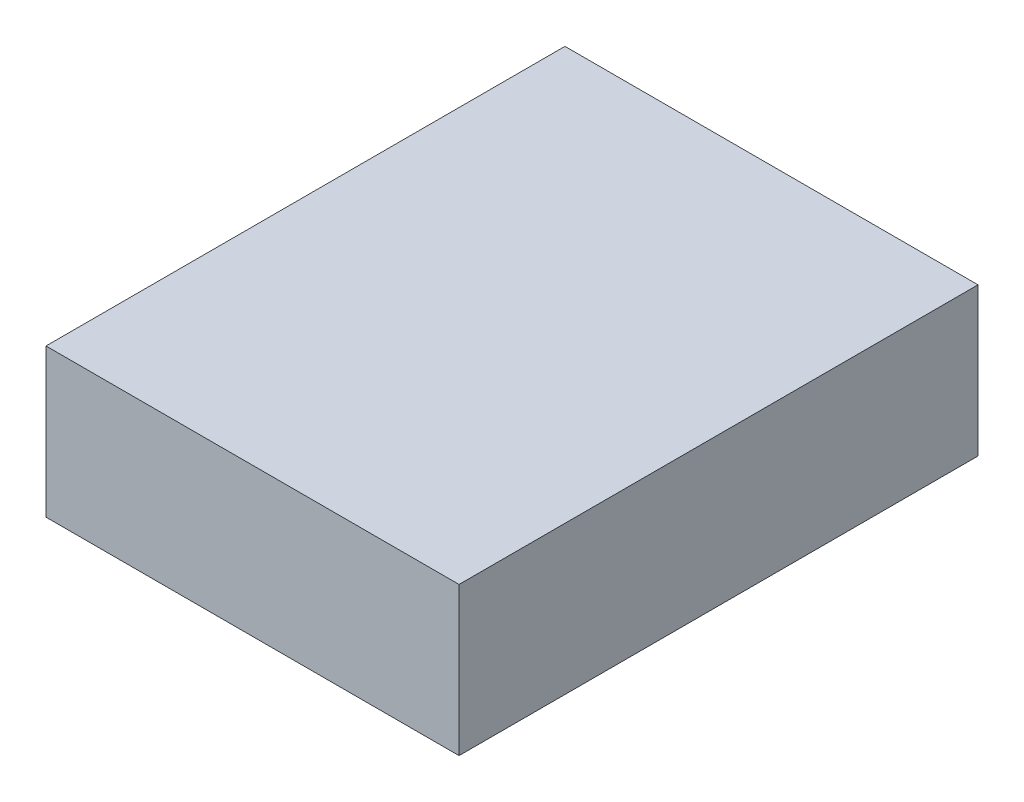
from build123d import *

# Parameters (mm, degrees)
SKETCH2_W           = 39
SKETCH2_H           = 49
BOSS_EXTRUDE1_DEPTH = 14


with BuildPart() as part:
    # Sketch2 → Boss-Extrude1 (new body)
    with BuildSketch(Plane(origin=(0, 0, 0), x_dir=(1, 0, 0), z_dir=(0, 1, 0))):
        with Locations((-60.157010407, -5.748521195)):
            Rectangle(SKETCH2_W, SKETCH2_H)
    extrude(amount=BOSS_EXTRUDE1_DEPTH)


solid = part.part
